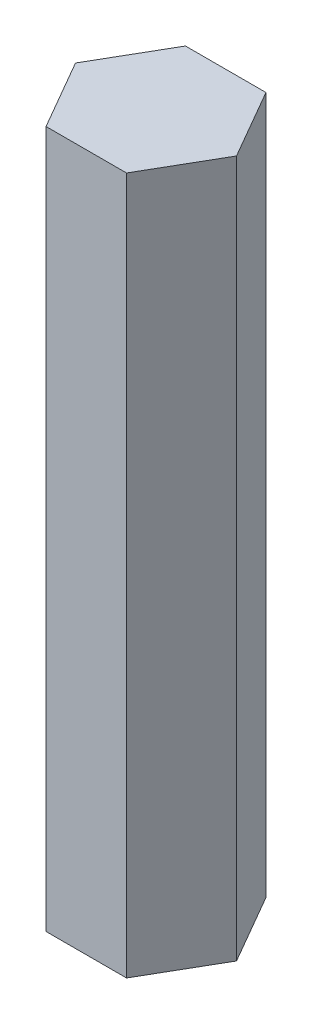
from build123d import *

# Parameters (mm, degrees)
EXTRUDE1_DEPTH = 100


with BuildPart() as part:
    # Sketch1 → Extrude1 (new body)
    with BuildSketch(Plane(origin=(0, 0, 0), x_dir=(1, 0, 0), z_dir=(0, 1, 0))):
        Polygon((-5.773502692, 10), (-11.547005384, 0), (-5.773502692, -10), (5.773502692, -10), (11.547005384, 0), (5.773502692, 10), align=None)
    extrude(amount=EXTRUDE1_DEPTH)


solid = part.part
